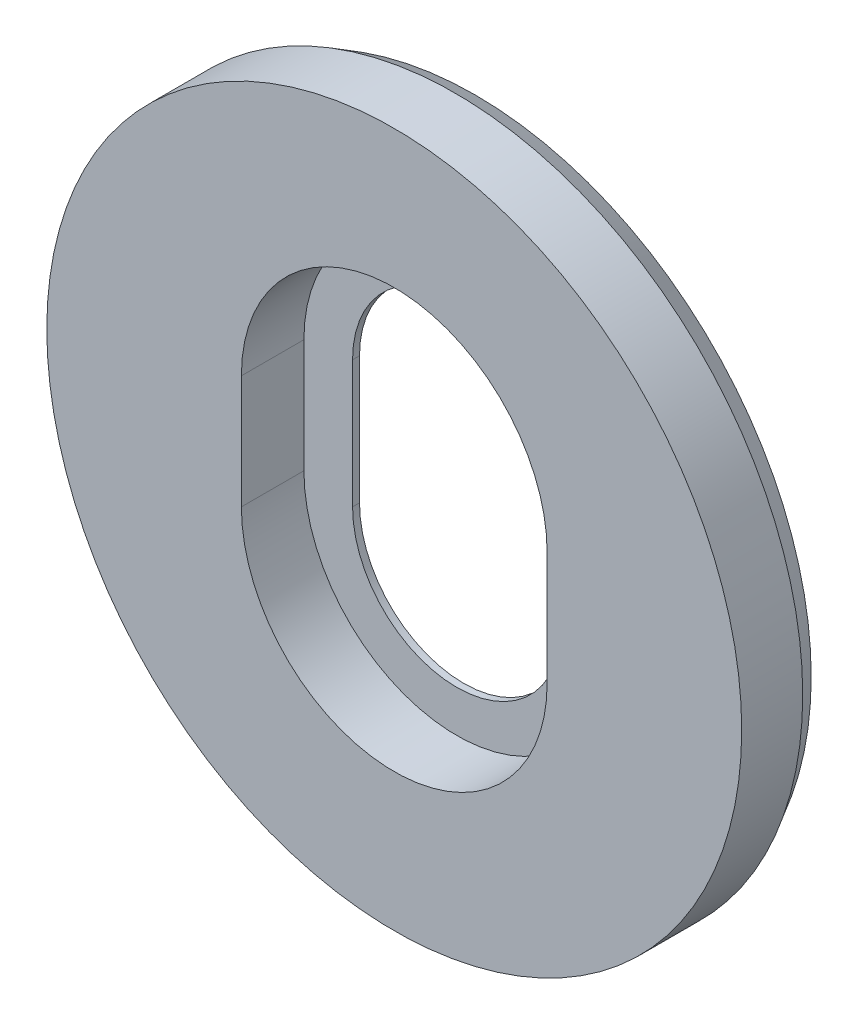
from build123d import *
from OCP.BRepFilletAPI import BRepFilletAPI_MakeChamfer

# Parameters (mm, degrees)
SKETCH_184_R           = 15
EXTRUDE_842_DEPTH      = 3.5
CUT_EXTRUDE_1179_DEPTH = 2.7
CHAMFER_1_SIZE         = 0.5
CHAMFER_1_SIZE2        = 0.866025404


with BuildPart() as part:
    # Sketch 184 → Extrude 842 (new body)
    with BuildSketch(Plane.XY):
        Circle(SKETCH_184_R)
        with BuildLine():
            Line((4.5, 2.75), (4.5, -2.75))
            ThreePointArc((4.5, -2.75), (0, -7.25), (-4.5, -2.75))
            Line((-4.5, -2.75), (-4.5, 2.75))
            ThreePointArc((-4.5, 2.75), (0, 7.25), (4.5, 2.75))
        make_face(mode=Mode.SUBTRACT)
    extrude(amount=EXTRUDE_842_DEPTH)

    # Эскиз1 → Cut-Extrude 1179 (cut)
    with BuildSketch(Plane.XY.offset(3.5)):
        with BuildLine():
            Line((6.6, 2.45), (6.6, -2.45))
            ThreePointArc((6.6, -2.45), (0, -9.05), (-6.6, -2.45))
            Line((-6.6, -2.45), (-6.6, 2.45))
            ThreePointArc((-6.6, 2.45), (0, 9.05), (6.6, 2.45))
        make_face()
    extrude(amount=-CUT_EXTRUDE_1179_DEPTH, mode=Mode.SUBTRACT)

    # Фаска1: one chamfer whose edges measure the first distance from different faces: ONE call of the kernel's chamfer builder (chamfer() names one face for all edges)
    chamfer_1_edges_1 = [part.edges().sort_by_distance(p)[0] for p in [
        (-15, 0, 0),
    ]]
    chamfer_1_side_1 = [part.faces().sort_by_distance(p)[0] for p in [
        (-14.575735931, 0, 0),
    ]]
    chamfer_1_edges_2 = [part.edges().sort_by_distance(p)[0] for p in [
        (0, 7.25, 0),
    ]]
    chamfer_1_side_2 = [part.faces().sort_by_distance(p)[0] for p in [
        (0, 7.25, 0.4),
    ]]
    chamfer_1_edges_3 = [part.edges().sort_by_distance(p)[0] for p in [
        (-4.5, 0, 0),
    ]]
    chamfer_1_side_3 = [part.faces().sort_by_distance(p)[0] for p in [
        (-4.5, 0, 0.4),
    ]]
    chamfer_1_edges_4 = [part.edges().sort_by_distance(p)[0] for p in [
        (0, -7.25, 0),
    ]]
    chamfer_1_side_4 = [part.faces().sort_by_distance(p)[0] for p in [
        (0, -7.25, 0.4),
    ]]
    chamfer_1_edges_5 = [part.edges().sort_by_distance(p)[0] for p in [
        (4.5, 0, 0),
    ]]
    chamfer_1_side_5 = [part.faces().sort_by_distance(p)[0] for p in [
        (4.5, 0, 0.4),
    ]]
    chamfer_1 = BRepFilletAPI_MakeChamfer(part.part.solid().wrapped)
    for e in chamfer_1_edges_1:
        chamfer_1.Add(CHAMFER_1_SIZE, CHAMFER_1_SIZE2, e.wrapped, chamfer_1_side_1[0].wrapped)  # the first distance lies on this face
    for e in chamfer_1_edges_2:
        chamfer_1.Add(CHAMFER_1_SIZE, CHAMFER_1_SIZE2, e.wrapped, chamfer_1_side_2[0].wrapped)  # the first distance lies on this face
    for e in chamfer_1_edges_3:
        chamfer_1.Add(CHAMFER_1_SIZE, CHAMFER_1_SIZE2, e.wrapped, chamfer_1_side_3[0].wrapped)  # the first distance lies on this face
    for e in chamfer_1_edges_4:
        chamfer_1.Add(CHAMFER_1_SIZE, CHAMFER_1_SIZE2, e.wrapped, chamfer_1_side_4[0].wrapped)  # the first distance lies on this face
    for e in chamfer_1_edges_5:
        chamfer_1.Add(CHAMFER_1_SIZE, CHAMFER_1_SIZE2, e.wrapped, chamfer_1_side_5[0].wrapped)  # the first distance lies on this face
    add(Compound.cast(chamfer_1.Shape()), mode=Mode.REPLACE)


solid = part.part
